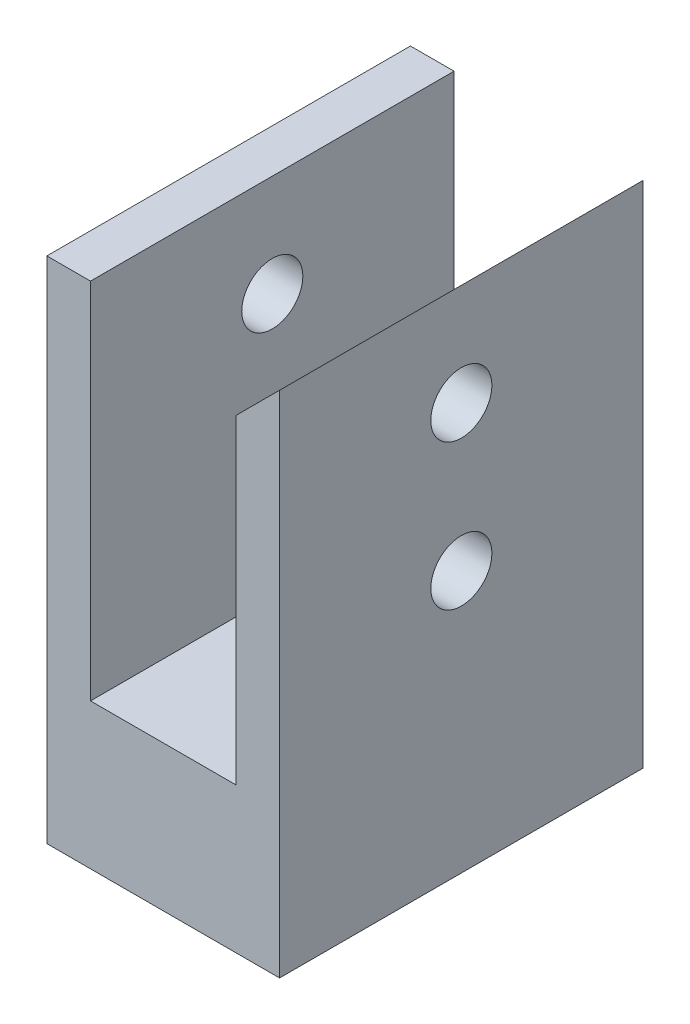
from build123d import *

# Parameters (mm, degrees)
EXTRUDE_1_DEPTH          = 25
SKETCH_2_R               = 2.1
CUT_EXTRUDE_1_DEPTH      = 37.249137921
CUT_EXTRUDE_2_DEPTH      = 37.249137921
CUT_EXTRUDE_2_DEPTH_BACK = 37.249137921
SKETCH_2_2_R             = 2.1


with BuildPart() as part:
    # 草图1 → 凸台-拉伸1 (new body)
    with BuildSketch(Plane.XY):
        Polygon((-8, -10), (8, -10), (8, 25), (5, 22), (5, 0), (-5, 0), (-5, 25), (-8, 25), align=None)
    extrude(amount=EXTRUDE_1_DEPTH)

    # 草图2 → 切除-拉伸1 (cut, through all)
    with BuildSketch(Plane(origin=(0, 0, 0), x_dir=(0, 0, -1), z_dir=(1, 0, 0))):
        with Locations((-12.5, 8)):
            Circle(SKETCH_2_R)
        with Locations((-12.5, 18)):
            Circle(SKETCH_2_R)
    extrude(amount=-CUT_EXTRUDE_1_DEPTH, mode=Mode.SUBTRACT)

    # 草图2<2> → 切除-拉伸2 (cut, two sides: drawn at the far end of the back side and taken through both)
    with BuildSketch(Plane(origin=(0, 0, 0), x_dir=(0, 0, -1), z_dir=(1, 0, 0)).offset(-CUT_EXTRUDE_2_DEPTH_BACK)):
        with Locations((-12.5, 8)):
            Circle(SKETCH_2_2_R)
        with Locations((-12.5, 18)):
            Circle(SKETCH_2_2_R)
    extrude(amount=CUT_EXTRUDE_2_DEPTH + CUT_EXTRUDE_2_DEPTH_BACK, mode=Mode.SUBTRACT)


solid = part.part
